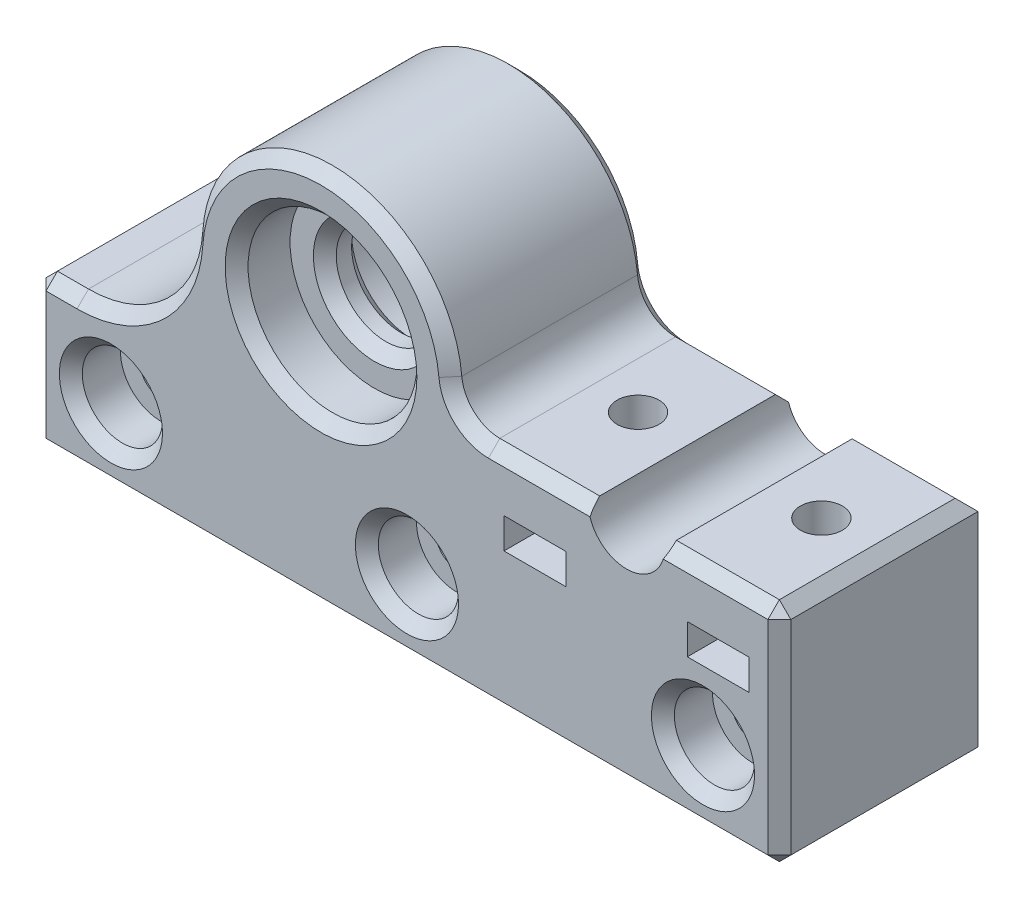
from build123d import *
from OCP.BRepFilletAPI import BRepFilletAPI_MakeChamfer

# Parameters (mm, degrees)
SKETCH1_R           = 2.675
SKETCH1_R_2         = 6.5
BOSS_EXTRUDE1_DEPTH = 26
CUT_EXTRUDE2_START  = 6
SKETCH1_4_R         = 11.05
SKETCH1_4_R_2       = 6.5
CUT_EXTRUDE2_DEPTH  = 8
SKETCH5_R           = 11.05
CUT_EXTRUDE6_DEPTH  = 6
CUT_EXTRUDE6_DRAFT  = 5
SKETCH4_R           = 5.25
CUT_EXTRUDE5_DEPTH  = 6.5
CUT_EXTRUDE10_START = -7
SKETCH9_R           = 11.05
CUT_EXTRUDE10_DEPTH = 7
CHAMFER5_SIZE       = 1.5
CHAMFER5_SIZE2      = 1.650094301
SKETCH6_R           = 2.75
CUT_EXTRUDE7_DEPTH  = 14
CUT_EXTRUDE8_START  = -7
SKETCH7_R           = 2.75
SKETCH7_W           = 8.1
SKETCH7_H           = 1.5
CUT_EXTRUDE8_DEPTH  = 4


with BuildPart() as part:
    # Sketch1 → Boss-Extrude1 (new body)
    with BuildSketch(Plane.XY):
        with BuildLine():
            Line((-37.5, -32.7), (60, -32.7))
            Line((60, -32.7), (60, -3))
            Line((60, -3), (45.025, -3))
            ThreePointArc((45.025, -3), (40, -8.025), (34.975, -3))
            Line((34.975, -3), (21.9089023, -3))
            ThreePointArc((21.9089023, -3), (18.537902988, -1.692744729), (16.929606323, 1.545454545))
            ThreePointArc((16.929606323, 1.545454545), (-0.242190945, 16.998274723), (-16.966764387, 1.0625))
            ThreePointArc((-16.966764387, 1.0625), (-21.667640892, -8.933034803), (-31.937438845, -13))
            Line((-31.937438845, -13), (-37.5, -13))
            Line((-37.5, -13), (-37.5, -32.7))
        make_face()
        with Locations(Location((-27.5, -23, 0), (0, 0, 180))):
            Circle(SKETCH1_R, mode=Mode.SUBTRACT)
        with Locations(Location((50, -23, 0), (0, 0, 180))):
            Circle(SKETCH1_R, mode=Mode.SUBTRACT)
        with Locations(Location((0, 0, 0), (0, 0, 180))):
            Circle(SKETCH1_R_2, mode=Mode.SUBTRACT)
        with Locations(Location((11.25, -23, 0), (0, 0, 180))):
            Circle(SKETCH1_R, mode=Mode.SUBTRACT)
    extrude(amount=BOSS_EXTRUDE1_DEPTH)

    # Sketch1<4> → Cut-Extrude2 (cut)
    with BuildSketch(Plane.XY.offset(CUT_EXTRUDE2_START)):
        Circle(SKETCH1_4_R)
        with Locations(Location((0, 0, 0), (0, 0, 180))):
            Circle(SKETCH1_4_R_2, mode=Mode.SUBTRACT)
    extrude(amount=CUT_EXTRUDE2_DEPTH, mode=Mode.SUBTRACT)


with BuildPart() as cut_extrude6_tool:
    # Sketch5 → Cut-Extrude6 (with draft: the straight prism first)
    with BuildSketch(Plane.XY.offset(6)):
        Circle(SKETCH5_R)
    extrude(amount=-CUT_EXTRUDE6_DEPTH)
    # Cut-Extrude6: the draft: its side faces are tilted about the plane it starts from
    cut_extrude6_sides = [cut_extrude6_tool.faces().sort_by_distance(p)[0] for p in [
        (-11.05, 0, 3),
    ]]
    draft(cut_extrude6_sides, Plane.XY.offset(6), CUT_EXTRUDE6_DRAFT)


with BuildPart() as part_1:
    add(part.part)

    # Cut-Extrude6: cut by cut_extrude6_tool
    add(cut_extrude6_tool.part, mode=Mode.SUBTRACT)

    # Sketch4 → Cut-Extrude5 (cut)
    with BuildSketch(Plane.XY.offset(26)):
        with Locations((-27.5, -23)):
            Circle(SKETCH4_R)
        with Locations((50, -23)):
            Circle(SKETCH4_R)
        with Locations((11.25, -23)):
            Circle(SKETCH4_R)
    extrude(amount=-CUT_EXTRUDE5_DEPTH, mode=Mode.SUBTRACT)

    # Sketch9 → Cut-Extrude10 (cut)
    with BuildSketch(Plane.XY.offset(26).offset(CUT_EXTRUDE10_START)):
        Circle(SKETCH9_R)
    extrude(amount=CUT_EXTRUDE10_DEPTH, mode=Mode.SUBTRACT)

    # Chamfer5: one chamfer whose edges measure the first distance from different faces: ONE call of the kernel's chamfer builder (chamfer() names one face for all edges)
    chamfer5_edges_1 = [part_1.edges().sort_by_distance(p)[0] for p in [
        (28.44195115, -3, 26),
        (18.537902988, -1.692744729, 26),
        (52.5125, -3, 0),
        (-34.718719423, -13, 0),
        (-21.667640892, -8.933034803, 0),
        (-0.242190945, 16.998274723, 0),
        (-0.242190945, 16.998274723, 26),
        (18.537902988, -1.692744729, 0),
        (28.44195115, -3, 0),
        (-21.667640892, -8.933034803, 26),
        (60, -3, 13),
        (60, -32.7, 13),
        (-37.5, -32.7, 13),
        (-37.5, -13, 13),
        (-34.718719423, -13, 26),
        (-37.5, -22.85, 26),
        (11.25, -32.7, 26),
        (60, -17.85, 26),
        (6.5, 0, 14),
        (52.5125, -3, 26),
        (-32.75, -23, 26),
        (44.75, -23, 26),
        (6, -23, 26),
        (6.5, 0, 19),
        (-11.05, 0, 26),
    ]]
    chamfer5_edges_2 = [part_1.edges().sort_by_distance(p)[0] for p in [
        (-11.574931981, 0, 0),
    ]]
    chamfer5_side_2 = [part_1.faces().sort_by_distance(p)[0] for p in [
        (12.610092139, -16.470965453, 0),
    ]]
    chamfer5 = BRepFilletAPI_MakeChamfer(part_1.part.solid().wrapped)
    for e in chamfer5_edges_1:
        chamfer5.Add(CHAMFER5_SIZE, e.wrapped)
    for e in chamfer5_edges_2:
        chamfer5.Add(CHAMFER5_SIZE, CHAMFER5_SIZE2, e.wrapped, chamfer5_side_2[0].wrapped)  # the first distance lies on this face
    add(Compound.cast(chamfer5.Shape()), mode=Mode.REPLACE)

    # Sketch6 → Cut-Extrude7 (cut)
    with BuildSketch(Plane(origin=(0, -3, 0), x_dir=(1, 0, 0), z_dir=(0, 1, 0))):
        with Locations(Location((52, -12.5, 0), (0, 0, 180))):
            Circle(SKETCH6_R)
        with Locations(Location((28, -12.5, 0), (0, 0, 180))):
            Circle(SKETCH6_R)
    extrude(amount=-CUT_EXTRUDE7_DEPTH, mode=Mode.SUBTRACT)

    # Sketch7 → Cut-Extrude8 (cut)
    # profile 1 of 5: a face of its own
    with BuildSketch(Plane(origin=(0, -3, 0), x_dir=(1, 0, 0), z_dir=(0, 1, 0)).offset(CUT_EXTRUDE8_START)):
        Polygon((23.95, -10.16173141), (23.95, -14.83826859), (28, -17.17653718), (32.05, -14.83826859), (32.05, -10.16173141), (28, -7.82346282), align=None)
        with Locations(Location((28, -12.5, 0), (0, 0, 180))):
            Circle(SKETCH7_R, mode=Mode.SUBTRACT)
    # profile 2 of 5: a face of its own
    with BuildSketch(Plane(origin=(0, -3, 0), x_dir=(1, 0, 0), z_dir=(0, 1, 0)).offset(CUT_EXTRUDE8_START)):
        Polygon((28, -17.17653718), (23.95, -14.83826859), (23.95, -24.5), (32.05, -24.5), (32.05, -14.83826859), align=None)
    # profile 3 of 5: a face of its own
    with BuildSketch(Plane(origin=(0, -3, 0), x_dir=(1, 0, 0), z_dir=(0, 1, 0)).offset(CUT_EXTRUDE8_START)):
        Polygon((47.95, -10.16173141), (47.95, -14.83826859), (52, -17.17653718), (56.05, -14.83826859), (56.05, -10.16173141), (52, -7.82346282), align=None)
    # profile 4 of 5: a face of its own
    with BuildSketch(Plane(origin=(0, -3, 0), x_dir=(1, 0, 0), z_dir=(0, 1, 0)).offset(CUT_EXTRUDE8_START)):
        Polygon((47.95, -26), (56.05, -26), (56.05, -14.83826859), (52, -17.17653718), (47.95, -14.83826859), align=None)
    # profile 5 of 5: a face of its own
    with BuildSketch(Plane(origin=(0, -3, 0), x_dir=(1, 0, 0), z_dir=(0, 1, 0)).offset(CUT_EXTRUDE8_START)):
        with Locations((28, -25.25)):
            Rectangle(SKETCH7_W, SKETCH7_H)
    extrude(amount=-CUT_EXTRUDE8_DEPTH, mode=Mode.SUBTRACT)


solid = part_1.part
